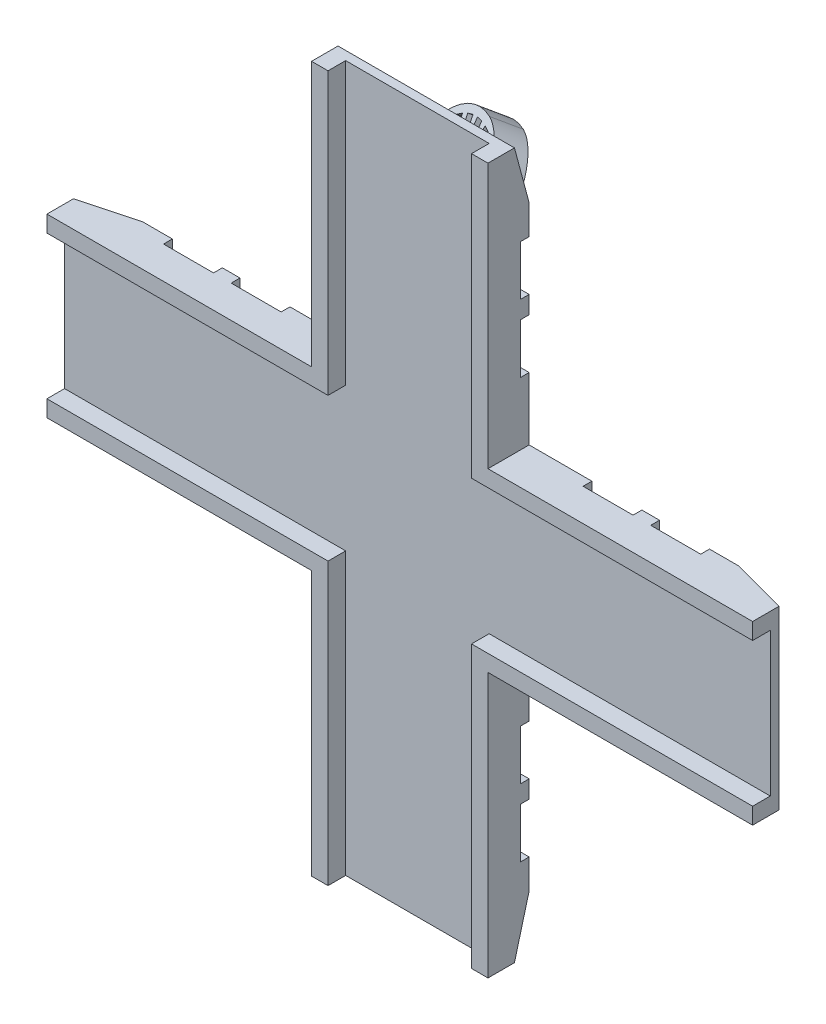
from build123d import *
from OCP.BRepFilletAPI import BRepFilletAPI_MakeChamfer

# Parameters (mm, degrees)
SKETCH1_W           = 1.85
SKETCH1_H           = 38.85
SKETCH1_H_2         = 6.15
SKETCH1_W_2         = 44.85
SKETCH1_H_3         = 1.85
SKETCH1_W_3         = 0.15
BOSS_EXTRUDE1_DEPTH = 3
SKETCH1_4_W         = 120
SKETCH1_4_H         = 30
SKETCH1_4_W_2       = 30
SKETCH1_4_H_2       = 120
BOSS_EXTRUDE3_DEPTH = 4
BOSS_EXTRUDE9_DEPTH = 3
CHAMFER1_SIZE       = 2.5
CHAMFER1_SIZE2      = 9.330127019
SKETCH4_W           = 8.5
SKETCH4_H           = 30
SKETCH4_W_2         = 30
SKETCH4_H_2         = 8.5
CUT_EXTRUDE1_DEPTH  = 1.5
BOSS_EXTRUDE7_DEPTH = 4.7625
SKETCH10_R          = 14.258178215
CUT_EXTRUDE2_DEPTH  = 91.287114527
FILLET1_R           = 1.75
BOSS_EXTRUDE8_DEPTH = 4.7625
CUT_EXTRUDE3_DEPTH  = 97.69049149


with BuildPart() as part:
    # Sketch1 → Boss-Extrude1 (new body)
    with BuildSketch(Plane(origin=(0, 0, 0), x_dir=(-1, 0, 0), z_dir=(0, 0, -1))):
        with Locations((14.075, 40.575)):
            Rectangle(SKETCH1_W, SKETCH1_H)
        with Locations((14.075, 18.075)):
            Rectangle(SKETCH1_W, SKETCH1_H_2)
        with Locations((37.575, 14.075)):
            Rectangle(SKETCH1_W_2, SKETCH1_H_3)
        with Locations((14.075, 14.075)):
            Rectangle(SKETCH1_W, SKETCH1_H_3)
        with Locations((14.075, -14.075)):
            Rectangle(SKETCH1_W, SKETCH1_H_3)
        with Locations((14.075, -18.075)):
            Rectangle(SKETCH1_W, SKETCH1_H_2)
        with Locations((37.575, -14.075)):
            Rectangle(SKETCH1_W_2, SKETCH1_H_3)
        with Locations((14.075, -40.575)):
            Rectangle(SKETCH1_W, SKETCH1_H)
        with Locations((-14.075, -14.075)):
            Rectangle(SKETCH1_W, SKETCH1_H_3)
        with Locations((-14.075, -18.075)):
            Rectangle(SKETCH1_W, SKETCH1_H_2)
        with Locations((-37.575, -14.075)):
            Rectangle(SKETCH1_W_2, SKETCH1_H_3)
        with Locations((-15.075, -14.075)):
            Rectangle(SKETCH1_W_3, SKETCH1_H_3)
        with Locations((15.075, -14.075)):
            Rectangle(SKETCH1_W_3, SKETCH1_H_3)
        with Locations((15.075, 14.075)):
            Rectangle(SKETCH1_W_3, SKETCH1_H_3)
        with Locations((-37.575, 14.075)):
            Rectangle(SKETCH1_W_2, SKETCH1_H_3)
        with Locations((-15.075, 14.075)):
            Rectangle(SKETCH1_W_3, SKETCH1_H_3)
        with Locations((-14.075, 18.075)):
            Rectangle(SKETCH1_W, SKETCH1_H_2)
        with Locations((-14.075, 14.075)):
            Rectangle(SKETCH1_W, SKETCH1_H_3)
        with Locations((-14.075, 40.575)):
            Rectangle(SKETCH1_W, SKETCH1_H)
        with Locations((-14.075, -40.575)):
            Rectangle(SKETCH1_W, SKETCH1_H)
    extrude(amount=-BOSS_EXTRUDE1_DEPTH)

    # Sketch1<4> → Boss-Extrude3 (add)
    with BuildSketch(Plane(origin=(0, 0, 0), x_dir=(-1, 0, 0), z_dir=(0, 0, -1))):
        Rectangle(SKETCH1_4_W, SKETCH1_4_H)
        Rectangle(SKETCH1_4_W_2, SKETCH1_4_H_2)
    extrude(amount=BOSS_EXTRUDE3_DEPTH)

    # Sketch13 → Boss-Extrude9 (add)
    with BuildSketch(Plane.XY):
        Polygon((-12.2, 12.2), (-60, 12.2), (-60, 13.15), (-13.15, 13.15), (-13.15, 60), (-12.2, 60), align=None)
        Polygon((-60, -12.2), (-12.2, -12.2), (-12.2, -60), (-13.15, -60), (-13.15, -13.15), (-60, -13.15), align=None)
        Polygon((12.2, -60), (12.2, -12.2), (60, -12.2), (60, -13.15), (13.15, -13.15), (13.15, -60), align=None)
        Polygon((60, 12.2), (12.2, 12.2), (12.2, 60), (13.15, 60), (13.15, 13.15), (60, 13.15), align=None)
    extrude(amount=BOSS_EXTRUDE9_DEPTH)

    # Chamfer1: one chamfer whose edges measure the first distance from different faces: ONE call of the kernel's chamfer builder (chamfer() names one face for all edges)
    chamfer1_edges_1 = [part.edges().sort_by_distance(p)[0] for p in [
        (60, 0, -4),
    ]]
    chamfer1_side_1 = [part.faces().sort_by_distance(p)[0] for p in [
        (60, 0, -1.570175439),
    ]]
    chamfer1_edges_2 = [part.edges().sort_by_distance(p)[0] for p in [
        (0, 60, -4),
    ]]
    chamfer1_side_2 = [part.faces().sort_by_distance(p)[0] for p in [
        (0, 60, -1.570175439),
    ]]
    chamfer1_edges_3 = [part.edges().sort_by_distance(p)[0] for p in [
        (0, -60, -4),
    ]]
    chamfer1_side_3 = [part.faces().sort_by_distance(p)[0] for p in [
        (0, -60, -1.570175439),
    ]]
    chamfer1_edges_4 = [part.edges().sort_by_distance(p)[0] for p in [
        (-60, 0, -4),
    ]]
    chamfer1_side_4 = [part.faces().sort_by_distance(p)[0] for p in [
        (-60, 0, -1.570175439),
    ]]
    chamfer1 = BRepFilletAPI_MakeChamfer(part.part.solid().wrapped)
    for e in chamfer1_edges_1:
        chamfer1.Add(CHAMFER1_SIZE, CHAMFER1_SIZE2, e.wrapped, chamfer1_side_1[0].wrapped)  # the first distance lies on this face
    for e in chamfer1_edges_2:
        chamfer1.Add(CHAMFER1_SIZE, CHAMFER1_SIZE2, e.wrapped, chamfer1_side_2[0].wrapped)  # the first distance lies on this face
    for e in chamfer1_edges_3:
        chamfer1.Add(CHAMFER1_SIZE, CHAMFER1_SIZE2, e.wrapped, chamfer1_side_3[0].wrapped)  # the first distance lies on this face
    for e in chamfer1_edges_4:
        chamfer1.Add(CHAMFER1_SIZE, CHAMFER1_SIZE2, e.wrapped, chamfer1_side_4[0].wrapped)  # the first distance lies on this face
    add(Compound.cast(chamfer1.Shape()), mode=Mode.REPLACE)

    # Sketch4 → Cut-Extrude1 (cut)
    with BuildSketch(Plane(origin=(0, 0, -4), x_dir=(-1, 0, 0), z_dir=(0, 0, -1))):
        with Locations((-41.419872981, 0)):
            Rectangle(SKETCH4_W, SKETCH4_H)
        with Locations((-29.919872981, 0)):
            Rectangle(SKETCH4_W, SKETCH4_H)
        with Locations((0, 41.419872981)):
            Rectangle(SKETCH4_W_2, SKETCH4_H_2)
        with Locations((0, 29.919872981)):
            Rectangle(SKETCH4_W_2, SKETCH4_H_2)
        with Locations((29.919872981, 0)):
            Rectangle(SKETCH4_W, SKETCH4_H)
        with Locations((41.419872981, 0)):
            Rectangle(SKETCH4_W, SKETCH4_H)
        with Locations((0, -29.919872981)):
            Rectangle(SKETCH4_W_2, SKETCH4_H_2)
        with Locations((0, -41.419872981)):
            Rectangle(SKETCH4_W_2, SKETCH4_H_2)
    extrude(amount=-CUT_EXTRUDE1_DEPTH, mode=Mode.SUBTRACT)

    # Sketch9 → Boss-Extrude7 (add)
    with BuildSketch(Plane(origin=(-2.248627702, 2.248627702, 3.180039793), x_dir=(-0.86602540378444, -0.28867513459481, -0.40824829046386224), z_dir=(0.4999999999999977, -0.49999999999999806, -0.7071067811865507))):
        with BuildLine():
            Line((26.502649854, 26.860285477), (21.488288715, 19.768907948))
            Line((21.488288715, 19.768907948), (7.054531985, -0.643506575))
            Line((7.054531985, -0.643506575), (-2.958214479, 6.436574348))
            Line((-2.958214479, 6.436574348), (11.475542251, 26.848988872))
            Line((11.475542251, 26.848988872), (16.48990339, 33.940366401))
            ThreePointArc((16.48990339, 33.940366401), (25.036317083, 35.406699171), (26.502649854, 26.860285477))
        make_face()
        with BuildLine():
            ThreePointArc((19.161917241, 33.60764173), (16.307451178, 27.650713492), (22.309959452, 24.893384176))
            ThreePointArc((22.309959452, 24.893384176), (25.022858564, 30.799171082), (19.161917241, 33.60764173))
        make_face(mode=Mode.SUBTRACT)
    extrude(amount=BOSS_EXTRUDE7_DEPTH)

    # Sketch10 → Cut-Extrude2 (cut, through all)
    with BuildSketch(Plane.XY):
        Circle(SKETCH10_R)
    extrude(amount=CUT_EXTRUDE2_DEPTH, mode=Mode.SUBTRACT)

    # Fillet1
    fillet1_edges = [part.edges().sort_by_distance(p)[0] for p in [
        (-2.56318253, 2.56318253, -4),
        (-7.32568253, 7.32568253, -4),
        (-9.280078929, 0.60878613, -4),
        (-0.60878613, 9.280078929, -4),
    ]]
    fillet(fillet1_edges, radius=FILLET1_R)

    # Sketch11 → Boss-Extrude8 (add)
    with BuildSketch(Plane(origin=(-2.248627702, 2.248627702, 3.180039793), x_dir=(0.86602540378444, 0.28867513459481003, 0.4082482904638624), z_dir=(-0.4999999999999978, 0.4999999999999982, 0.7071067811865503))):
        with BuildLine():
            ThreePointArc((-26.502649854, 26.860285477), (-25.036317083, 35.406699171), (-16.48990339, 33.940366401))
            Line((-16.48990339, 33.940366401), (-7.126405249, 20.698380338))
            ThreePointArc((-7.126405249, 20.698380338), (-10.454022038, 27.858169656), (-11.039574704, 35.731716801))
            ThreePointArc((-11.039574704, 35.731716801), (-12.744347828, 41.802023869), (-18.161788795, 45.027890059))
            ThreePointArc((-18.161788795, 45.027890059), (-29.902759178, 42.288887582), (-36.398772273, 32.132395373))
            ThreePointArc((-36.398772273, 32.132395373), (-35.163210117, 25.949494318), (-30.008327436, 22.318783113))
            ThreePointArc((-30.008327436, 22.318783113), (-22.780260221, 19.142203051), (-17.139151713, 13.618299415))
            Line((-17.139151713, 13.618299415), (-26.502649854, 26.860285477))
        make_face()
    extrude(amount=-BOSS_EXTRUDE8_DEPTH)

    # Sketch12 → Cut-Extrude3 (cut, through all)
    with BuildSketch(Plane(origin=(-2.248627702, 2.248627702, 3.180039793), x_dir=(0.86602540378444, 0.28867513459481003, 0.4082482904638624), z_dir=(-0.4999999999999978, 0.4999999999999982, 0.7071067811865503))):
        Polygon((-25.756076527, 43.091629588), (-27.225983794, 42.459670234), (-25.971939452, 39.542823), (-24.502032185, 40.174782353), align=None)
        Polygon((-28.527874077, 41.730147071), (-26.694786972, 39.137770427), (-28.001181502, 38.214009996), (-29.834268606, 40.80638664), align=None)
        Polygon((-22.761781271, 43.84707133), (-24.330959276, 43.53453271), (-23.710765452, 40.420695106), (-22.141587447, 40.733233726), align=None)
        Polygon((-19.675853381, 43.963455868), (-21.275721515, 43.983997418), (-21.316483655, 40.809259091), (-19.716615522, 40.78871754), align=None)
        Polygon((-16.633162714, 43.435696639), (-18.193799062, 43.788420596), (-18.893735665, 40.691532844), (-17.333099317, 40.338808886), align=None)
        Polygon((-13.766689451, 42.286859254), (-15.219886716, 42.956349889), (-16.548407194, 40.072661566), (-15.095209929, 39.403170932), align=None)
        Polygon((-30.956033068, 39.822127099), (-32.04181915, 38.646938354), (-29.709803985, 36.492331599), (-28.624017903, 37.667520343), align=None)
        Polygon((-32.934431301, 37.450959299), (-33.752154873, 36.075703628), (-31.023131901, 34.453033416), (-30.205408329, 35.828289087), align=None)
        Polygon((-34.376603279, 34.720275083), (-34.890525897, 33.205057758), (-31.883766517, 32.185242563), (-31.3698439, 33.700459888), align=None)
        Polygon((-35.219519168, 31.749418455), (-35.407179947, 30.160461743), (-32.254093972, 29.788072384), (-32.066433193, 31.377029095), align=None)
        Polygon((-35.426339496, 28.668230104), (-35.279536761, 27.074979039), (-32.117929178, 27.366290716), (-32.264731914, 28.959541782), align=None)
    extrude(amount=-CUT_EXTRUDE3_DEPTH, mode=Mode.SUBTRACT)


solid = part.part
